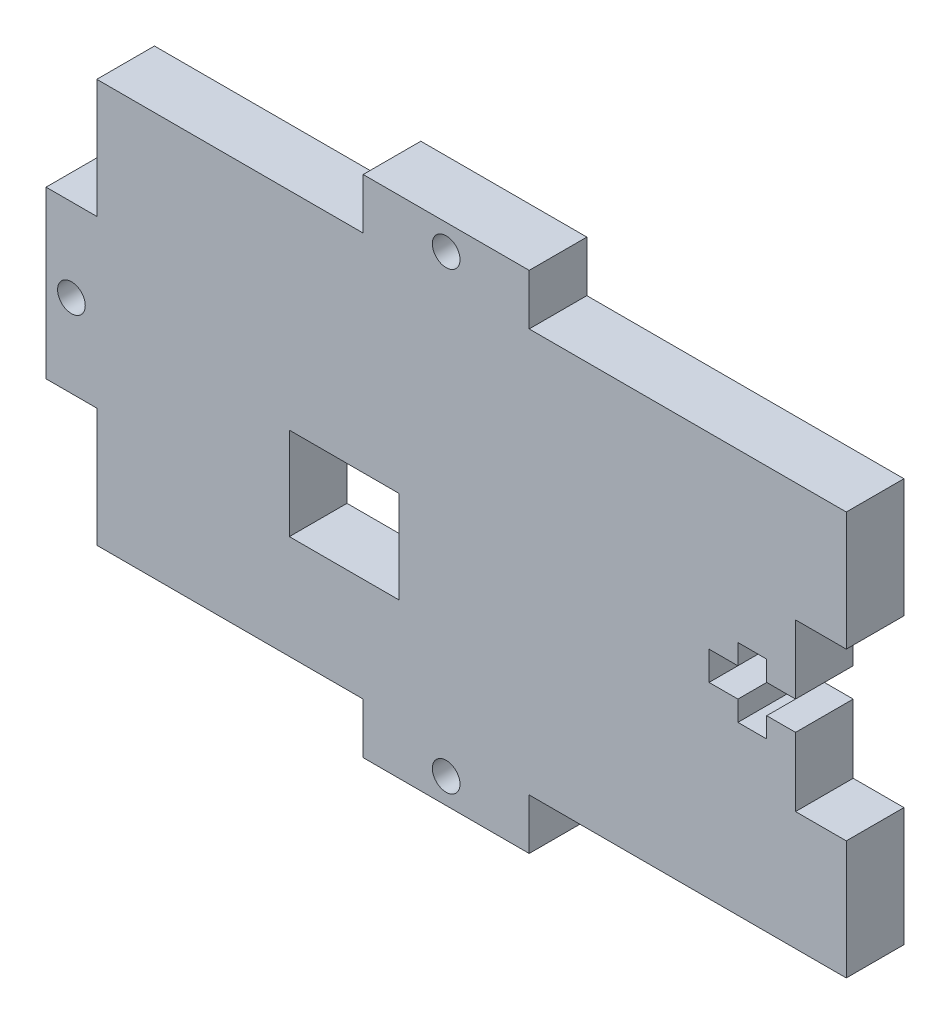
from build123d import *

# Parameters (mm, degrees)
SKETCH1_W           = 82.55
SKETCH1_H           = 44.45
BOSS_EXTRUDE1_DEPTH = 6.35
SKETCH2_W           = 5.588
SKETCH2_H           = 18.288
BOSS_EXTRUDE2_DEPTH = 6.35
SKETCH5_W           = 18.288
SKETCH5_H           = 5.588
BOSS_EXTRUDE3_DEPTH = 6.35
SKETCH3_W           = 5.588
SKETCH3_H           = 18.288
CUT_EXTRUDE1_DEPTH  = 97.739994025
SKETCH6_R           = 1.524
CUT_EXTRUDE2_DEPTH  = 97.739994025
SKETCH7_W           = 12.065
SKETCH7_H           = 10.16
CUT_EXTRUDE4_DEPTH  = 97.739994025


with BuildPart() as part:
    # Sketch1 → Boss-Extrude1 (new body)
    with BuildSketch(Plane.XY):
        with Locations((41.275, 22.225)):
            Rectangle(SKETCH1_W, SKETCH1_H)
    extrude(amount=BOSS_EXTRUDE1_DEPTH)

    # Sketch2 → Boss-Extrude2 (add)
    with BuildSketch(Plane.XY.offset(6.35)):
        with Locations((-2.794, 22.225)):
            Rectangle(SKETCH2_W, SKETCH2_H)
    extrude(amount=-BOSS_EXTRUDE2_DEPTH)

    # Sketch5 → Boss-Extrude3 (add)
    with BuildSketch(Plane.XY.offset(6.35)):
        with Locations((38.481, 47.244)):
            Rectangle(SKETCH5_W, SKETCH5_H)
        with Locations((38.481, -2.794)):
            Rectangle(SKETCH5_W, SKETCH5_H)
    extrude(amount=-BOSS_EXTRUDE3_DEPTH)

    # Sketch3 → Cut-Extrude1 (cut, through all)
    with BuildSketch(Plane.XY.offset(6.35)):
        with Locations((79.756, 22.225)):
            Rectangle(SKETCH3_W, SKETCH3_H)
    extrude(amount=-CUT_EXTRUDE1_DEPTH, mode=Mode.SUBTRACT)

    # Sketch6 → Cut-Extrude2 (cut, through all)
    with BuildSketch(Plane.XY.offset(6.35)):
        with Locations((-2.794, 22.225)):
            Circle(SKETCH6_R)
        with Locations((38.481, -2.794)):
            Circle(SKETCH6_R)
        with Locations((38.481, 47.244)):
            Circle(SKETCH6_R)
        Polygon((67.437, 23.8125), (70.612, 23.8125), (70.612, 26.035), (73.787, 26.035), (73.787, 23.8125), (76.962, 23.8125), (76.962, 20.6375), (73.787, 20.6375), (73.787, 18.415), (70.612, 18.415), (70.612, 20.6375), (67.437, 20.6375), align=None)
    extrude(amount=-CUT_EXTRUDE2_DEPTH, mode=Mode.SUBTRACT)

    # Sketch7 → Cut-Extrude4 (cut, through all)
    with BuildSketch(Plane.XY):
        with Locations((27.2415, 16.51)):
            Rectangle(SKETCH7_W, SKETCH7_H)
    extrude(amount=CUT_EXTRUDE4_DEPTH, mode=Mode.SUBTRACT)


solid = part.part
